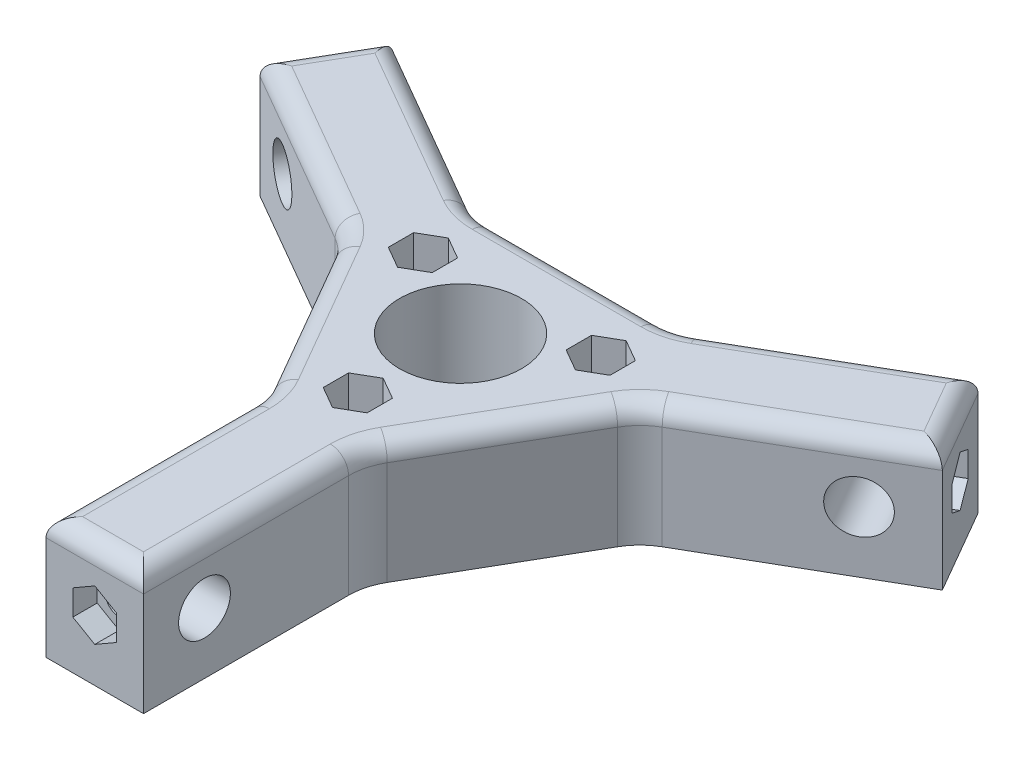
from build123d import *

# Parameters (mm, degrees)
SKETCH1_R                      = 10
BOSS_EXTRUDE1_DEPTH            = 20
CUT_EXTRUDE1_REACH             = 86.449
SKETCH2_R                      = 4.25
CUT_EXTRUDE1_DIRECTION_2_REACH = 86.449
CIRPATTERN1_COUNT              = 3
CUT_EXTRUDE4_REACH             = 115.696
CUT_EXTRUDE4_END_RADIUS        = 4.25
SKETCH4_R                      = 2.25
CUT_EXTRUDE5_DEPTH             = 4
CUT_EXTRUDE6_DEPTH             = 10
CUT_EXTRUDE7_START             = -10
SKETCH3_7_R                    = 2.5
CUT_EXTRUDE7_DEPTH             = 75.449346912
CIRPATTERN2_COUNT              = 3
FILLET1_R                      = 10
FILLET2_R                      = 3
CIRPATTERN3_COUNT              = 3


with BuildPart() as part:
    # Sketch1 → Boss-Extrude1 (new body)
    with BuildSketch(Plane(origin=(0, 0, 0), x_dir=(1, 0, 0), z_dir=(0, 1, 0))):
        Polygon((-16.512191497, 18.770922513), (-47.961524227, 36.92820323), (-55.961524227, 23.07179677), (-24.512191497, 4.914516052), (-8, -23.685438565), (-8, -60), (8, -60), (8, -23.685438565), (24.512191497, 4.914516052), (55.961524227, 23.07179677), (47.961524227, 36.92820323), (16.512191497, 18.770922513), align=None)
        with Locations(Location((0, 0, 0), (0, 0, 270))):
            Circle(SKETCH1_R, mode=Mode.SUBTRACT)
    extrude(amount=BOSS_EXTRUDE1_DEPTH)

    # Sketch2 → Cut-Extrude1 (cut, up to next)
    with BuildSketch(Plane(origin=(0, 0, 0), x_dir=(0.8660254037844387, 0, -0.4999999999999999), z_dir=(0.49999999999999994, 0, 0.8660254037844388)), mode=Mode.PRIVATE) as cut_extrude1_sk1:
        with Locations(Location((50, 10, 0), (0, 0, 180))):
            Circle(SKETCH2_R)
    cut_extrude1_tool1 = extrude(cut_extrude1_sk1.sketch, amount=-CUT_EXTRUDE1_REACH, mode=Mode.PRIVATE) & part.part
    cut_extrude1 = cut_extrude1_tool1.solids().sort_by_distance((43.30127, 10, -25))[0]
    add(cut_extrude1, mode=Mode.SUBTRACT)

    # Sketch2 → Cut-Extrude1 direction 2 (cut, up to next)
    with BuildSketch(Plane(origin=(0, 0, 0), x_dir=(0.8660254037844387, 0, -0.4999999999999999), z_dir=(0.49999999999999994, 0, 0.8660254037844388)), mode=Mode.PRIVATE) as cut_extrude1_direction_2_sk1:
        with Locations(Location((50, 10, 0), (0, 0, 180))):
            Circle(SKETCH2_R)
    cut_extrude1_direction_2_tool1 = extrude(cut_extrude1_direction_2_sk1.sketch, amount=CUT_EXTRUDE1_DIRECTION_2_REACH, mode=Mode.PRIVATE) & part.part
    cut_extrude1_direction_2 = cut_extrude1_direction_2_tool1.solids().sort_by_distance((43.30127, 10, -25))[0]
    add(cut_extrude1_direction_2, mode=Mode.SUBTRACT)

    # CirPattern1: Cut-Extrude1, Cut-Extrude1 direction 2 ×3 about axis
    cirpattern1_axis = Axis((0, 20, 0), (0, -1, 0))
    add([cut_extrude1.rotate(cirpattern1_axis, i * 360 / CIRPATTERN1_COUNT) for i in range(1, CIRPATTERN1_COUNT)], mode=Mode.SUBTRACT)
    add([cut_extrude1_direction_2.rotate(cirpattern1_axis, i * 360 / CIRPATTERN1_COUNT) for i in range(1, CIRPATTERN1_COUNT)], mode=Mode.SUBTRACT)

    # Cut-Extrude4: up to this cylinder (the profile starts outside it)
    cut_extrude4_end = Plane(origin=(0, 10, 50), z_dir=(1, 0, 0)) * Cylinder(CUT_EXTRUDE4_END_RADIUS, 240.892, mode=Mode.PRIVATE)
    # Sketch4 → Cut-Extrude4 (cut, up to the surface)
    with BuildSketch(Plane.XY.offset(60), mode=Mode.PRIVATE) as cut_extrude4_sk1:
        with Locations((0, 10)):
            Circle(SKETCH4_R)
    cut_extrude4_tool1 = extrude(cut_extrude4_sk1.sketch, amount=-CUT_EXTRUDE4_REACH, mode=Mode.PRIVATE) - cut_extrude4_end
    cut_extrude4 = cut_extrude4_tool1.solids().sort_by_distance((0, 10, 60))[0]
    add(cut_extrude4, mode=Mode.SUBTRACT)

    # Sketch4<3> → Cut-Extrude5 (cut)
    with BuildSketch(Plane.XY.offset(60)):
        Polygon((0, 14.156921938), (-3.6, 12.078460969), (-3.6, 7.921539031), (0, 5.843078062), (3.6, 7.921539031), (3.6, 12.078460969), align=None)
    cut_extrude5 = extrude(amount=-CUT_EXTRUDE5_DEPTH, mode=Mode.SUBTRACT)

    # Sketch3 → Cut-Extrude6 (cut)
    with BuildSketch(Plane(origin=(0, 20, 0), x_dir=(1, 0, 0), z_dir=(0, 1, 0))):
        Polygon((3.6, -18.921180251), (3.6, -14.764258313), (0, -12.685797344), (-3.6, -14.764258313), (-3.6, -18.921180251), (0, -20.99964122), align=None)
    cut_extrude6 = extrude(amount=-CUT_EXTRUDE6_DEPTH, mode=Mode.SUBTRACT)

    # Sketch3<7> → Cut-Extrude7 (cut, through all)
    with BuildSketch(Plane(origin=(0, 20, 0), x_dir=(1, 0, 0), z_dir=(0, 1, 0)).offset(CUT_EXTRUDE7_START)):
        with Locations(Location((0, -16.842719282, 0), (0, 0, 270))):
            Circle(SKETCH3_7_R)
    cut_extrude7 = extrude(amount=-CUT_EXTRUDE7_DEPTH, mode=Mode.SUBTRACT)

    # CirPattern2: Cut-Extrude6, Cut-Extrude7 ×3 about axis
    cirpattern2_axis = Axis((0, 0, 0), (0, 1, 0))
    add([cut_extrude6.rotate(cirpattern2_axis, i * 360 / CIRPATTERN2_COUNT) for i in range(1, CIRPATTERN2_COUNT)], mode=Mode.SUBTRACT)
    add([cut_extrude7.rotate(cirpattern2_axis, i * 360 / CIRPATTERN2_COUNT) for i in range(1, CIRPATTERN2_COUNT)], mode=Mode.SUBTRACT)

    # Fillet1
    fillet1_edges = [part.edges().sort_by_distance(p)[0] for p in [
        (-16.512191497, 10, -18.770922513),
        (16.512191497, 10, -18.770922513),
        (24.512191497, 10, -4.914516052),
        (8, 10, 23.685438565),
        (-8, 10, 23.685438565),
        (-24.512191497, 10, -4.914516052),
    ]]
    fillet(fillet1_edges, radius=FILLET1_R)

    # Fillet2
    fillet2_edges = [part.edges().sort_by_distance(p)[0] for p in [
        (16.256095748, 20, 9.385461256),
        (-33.3971119, 20, -28.519435853),
        (0, 20, -18.770922513),
        (33.3971119, 20, -28.519435853),
        (-8, 20, 43.182465244),
        (-16.256095748, 20, 9.385461256),
        (-41.3971119, 20, -14.663029392),
        (8.340741737, 20, 23.776740038),
        (-16.420890023, 20, -19.11166425),
        (16.420890023, 20, -19.11166425),
        (24.761631761, 20, -4.665075788),
        (-8.340741737, 20, 23.776740038),
        (-24.761631761, 20, -4.665075788),
        (0, 20, 60),
        (8, 20, 43.182465244),
        (41.3971119, 20, -14.663029392),
        (51.961524227, 20, -30),
        (-51.961524227, 20, -30),
    ]]
    fillet(fillet2_edges, radius=FILLET2_R)

    # CirPattern3: Cut-Extrude4, Cut-Extrude5 ×3 about axis
    cirpattern3_axis = Axis((0, 0, 0), (0, 1, 0))
    add([cut_extrude4.rotate(cirpattern3_axis, i * 360 / CIRPATTERN3_COUNT) for i in range(1, CIRPATTERN3_COUNT)], mode=Mode.SUBTRACT)
    add([cut_extrude5.rotate(cirpattern3_axis, i * 360 / CIRPATTERN3_COUNT) for i in range(1, CIRPATTERN3_COUNT)], mode=Mode.SUBTRACT)


solid = part.part
